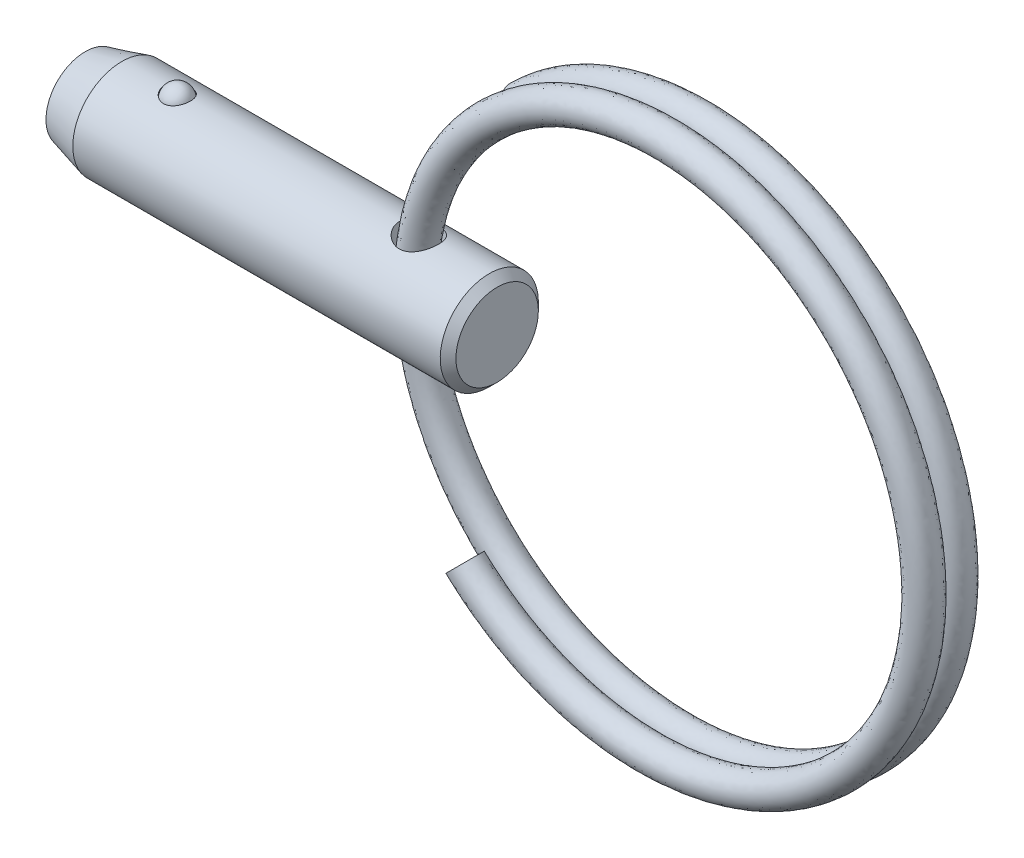
from build123d import *

# Parameters (mm, degrees)
SKETCH4_W          = 0.9525
SKETCH4_H          = 4.7625
SWEEP1_PITCH       = 1.5494
SWEEP1_HEIGHT      = 1.355725
SWEEP1_RADIUS      = 13.462
SKETCH6_R          = 0.762
SWEEP2_PITCH       = 1.5494
SWEEP2_HEIGHT      = 1.355725
SWEEP2_RADIUS      = 13.462
SWEEP2_START_ANGLE = -180
SKETCH6_2_R        = 0.762


with BuildPart() as part:
    # Sketch1 → Revolve1 (revolve)
    with BuildSketch(Plane.XY, mode=Mode.PRIVATE) as revolve1_sk:
        Polygon((9.9949, 2.00025), (9.6139, 2.38125), (-8.217510803, 2.38125), (-9.9949, 1.905), (-9.9949, 0), (9.9949, 0), align=None)
    revolve(revolve1_sk.sketch.rotate(Axis((9.9949, 0, 0), (1, 0, 0)), 180), axis=Axis((9.9949, 0, 0), (1, 0, 0)))

    # Sketch2 → Cut-Revolve1 (revolve, cut)
    with BuildSketch(Plane.XY):
        with BuildLine():
            Line((-4.844844331, 2.143125), (-6.210094331, 2.143125))
            ThreePointArc((-6.210094331, 2.143125), (-5.527469331, 2.82575), (-4.844844331, 2.143125))
        make_face()
    revolve(axis=Axis((-4.844844331, 2.143125, 0), (1, 0, 0)), mode=Mode.SUBTRACT)

    # Sketch4 → Cut-Revolve2 (revolve, cut)
    with BuildSketch(Plane.XY, mode=Mode.PRIVATE) as cut_revolve2_sk:
        with Locations((6.67385, 0)):
            Rectangle(SKETCH4_W, SKETCH4_H)
    revolve(cut_revolve2_sk.sketch.rotate(Axis((6.1976, -2.38125, 0), (0, 1, 0)), 180), axis=Axis((6.1976, -2.38125, 0), (0, 1, 0)), mode=Mode.SUBTRACT)


with BuildPart() as body_2:
    # Sketch3 → Revolve2 (revolve)
    with BuildSketch(Plane.XY):
        with BuildLine():
            Line((-4.870244331, 2.143125), (-6.184694331, 2.143125))
            ThreePointArc((-6.184694331, 2.143125), (-5.527469331, 2.80035), (-4.870244331, 2.143125))
        make_face()
    revolve(axis=Axis((-4.870244331, 2.143125, 0), (1, 0, 0)))


with BuildPart() as body_3:
    # Sweep1: sweep along a helix
    with BuildLine() as sweep1_path:
        Helix(SWEEP1_PITCH, SWEEP1_HEIGHT, SWEEP1_RADIUS, center=(18.777648906, 0, 0), direction=(0, 0, -1), lefthand=True)
    # Sketch6 → Sweep1 (sweep)
    with BuildSketch(Plane(origin=(114.003847968, 0, 0), x_dir=(0, 0, -1), z_dir=(0, 1, 0))):
        with Locations((0, 107.926199061)):
            Circle(SKETCH6_R)
    sweep(path=sweep1_path.line, is_frenet=True)

    # Sweep2: sweep along a helix
    with BuildLine() as sweep2_path:
        add(Helix(SWEEP2_PITCH, SWEEP2_HEIGHT, SWEEP2_RADIUS, center=(18.777648906, 0, 0), direction=(0, 0, 1), lefthand=True, mode=Mode.PRIVATE).rotate(Axis((18.777648906, 0, 0), (0, 0, 1)), SWEEP2_START_ANGLE))
    # Sketch6<2> → Sweep2 (sweep)
    with BuildSketch(Plane(origin=(114.003847968, 0, 0), x_dir=(0, 0, -1), z_dir=(0, 1, 0))):
        with Locations((0, 107.926199061)):
            Circle(SKETCH6_2_R)
    sweep(path=sweep2_path.line, is_frenet=True)


solid = Compound([part.part, body_2.part, body_3.part])
